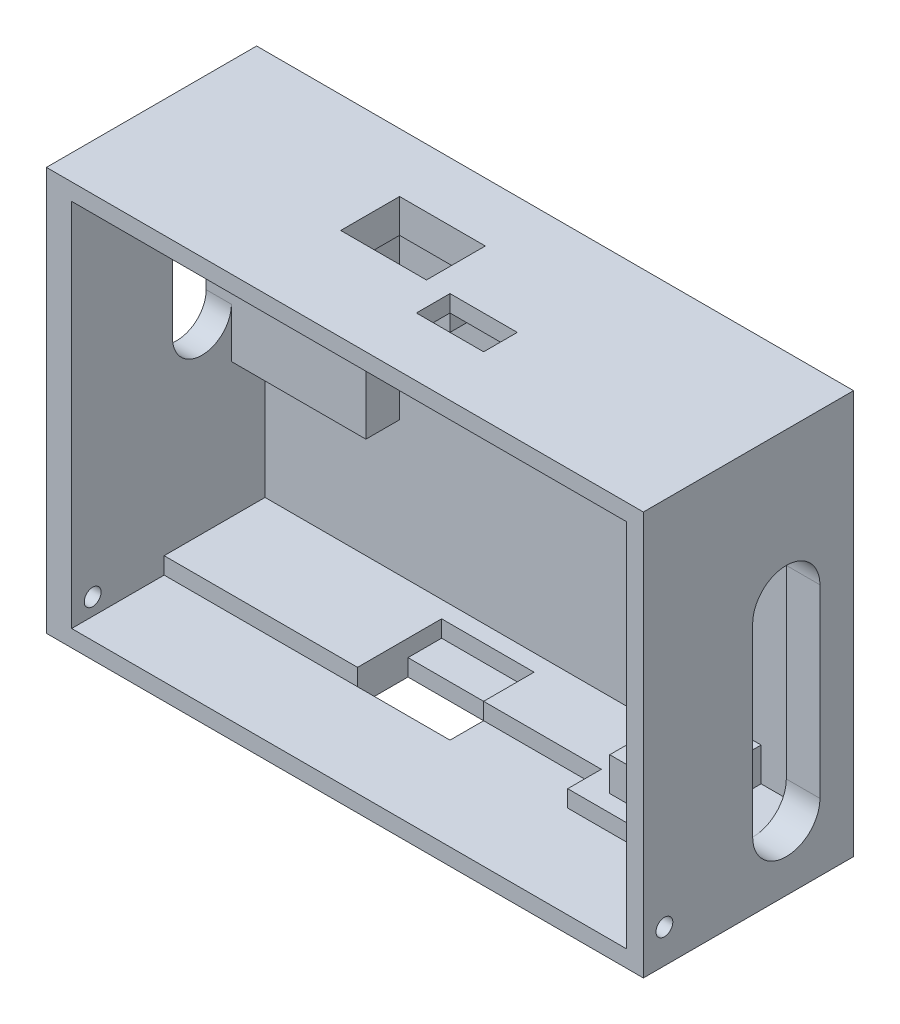
from build123d import *

# Parameters (mm, degrees)
SKETCH_1_W           = 35.5
SKETCH_1_H           = 24
EXTRUDE_1_DEPTH      = 12.5
SKETCH_2_W           = 33
SKETCH_2_H           = 22
CUT_EXTRUDE_1_DEPTH  = 11.5
CUT_EXTRUDE_2_DEPTH  = 2
EXTRUDE_2_DEPTH      = 6
SKETCH_7_W           = 4
SKETCH_7_H           = 2
SKETCH_7_W_2         = 5
EXTRUDE_3_DEPTH      = 5
CUT_EXTRUDE_4_DEPTH  = 2
SKETCH_11_R          = 0.5
CUT_EXTRUDE_5_DEPTH  = 35
SKETCH_12_W          = 5.5
SKETCH_12_H          = 1
CUT_EXTRUDE_6_DEPTH  = 5
SKETCH_15_W          = 5.5
SKETCH_15_H          = 3
CUT_EXTRUDE_7_DEPTH  = 5
SKETCH_16_W          = 5.1
SKETCH_16_H          = 3.5
CUT_EXTRUDE_8_DEPTH  = 5
SKETCH_18_W          = 7
SKETCH_18_H          = 1
FPC_DEPTH            = 2
SKETCH_19_W          = 8
SKETCH_19_H          = 12
USB_DEPTH            = 2
SKETCH_20_W          = 4
SKETCH_20_H          = 2
CUT_EXTRUDE_10_DEPTH = 2
SKETCH_21_W          = 4
SKETCH_21_H          = 1
CUT_EXTRUDE_11_DEPTH = 2


with BuildPart() as part:
    # 草图1 → 凸台-拉伸1 (new body)
    with BuildSketch(Plane.XY):
        Rectangle(SKETCH_1_W, SKETCH_1_H)
    extrude(amount=EXTRUDE_1_DEPTH)

    # 草图2 → 切除-拉伸1 (cut)
    with BuildSketch(Plane.XY.offset(12.5)):
        with Locations((0.25, 0)):
            Rectangle(SKETCH_2_W, SKETCH_2_H)
    extrude(amount=-CUT_EXTRUDE_1_DEPTH, mode=Mode.SUBTRACT)

    # 草图3 → 切除-拉伸2 (cut)
    with BuildSketch(Plane.ZY.offset(17.75)):
        with BuildLine():
            Line((6.5, 7.45), (6.5, 0.95))
            ThreePointArc((6.5, 0.95), (4.75, -0.8), (3, 0.95))
            Line((3, 0.95), (3, 7.45))
            ThreePointArc((3, 7.45), (4.75, 9.2), (6.5, 7.45))
        make_face()
    extrude(amount=-CUT_EXTRUDE_2_DEPTH, mode=Mode.SUBTRACT)

    # 草图6 → 凸台-拉伸2 (add)
    with BuildSketch(Plane.XY.offset(1)):
        Polygon((-16.25, 10), (15.75, 10), (15.75, -10), (-16.25, -10), (-16.25, -11), (16.75, -11), (16.75, 11), (-16.25, 11), align=None)
    extrude(amount=EXTRUDE_2_DEPTH)

    # 草图7 → 凸台-拉伸3 (add)
    with BuildSketch(Plane.XY.offset(1)):
        with Locations((11.25, -9)):
            Rectangle(SKETCH_7_W, SKETCH_7_H)
        with Locations((13.25, 9)):
            Rectangle(SKETCH_7_W_2, SKETCH_7_H)
    extrude(amount=EXTRUDE_3_DEPTH)

    # 草图10 → 切除-拉伸4 (cut)
    with BuildSketch(Plane.ZY.offset(-15.75)):
        with BuildLine():
            Line((2, -8), (2, 3))
            ThreePointArc((2, 3), (4, 5), (6, 3))
            Line((6, 3), (6, -8))
            ThreePointArc((6, -8), (4, -10), (2, -8))
        make_face()
    extrude(amount=-CUT_EXTRUDE_4_DEPTH, mode=Mode.SUBTRACT)

    # 草图11 → 切除-拉伸5 (cut)
    with BuildSketch(Plane(origin=(17.75, 0, 0), x_dir=(0, 0, -1), z_dir=(1, 0, 0))):
        with Locations((-11.25, -10)):
            Circle(SKETCH_11_R)
    extrude(amount=-CUT_EXTRUDE_5_DEPTH, mode=Mode.SUBTRACT)

    # 草图12 → 切除-拉伸6 (cut)
    with BuildSketch(Plane.XY.offset(7)):
        with Locations((-2, -10.5)):
            Rectangle(SKETCH_12_W, SKETCH_12_H)
    extrude(amount=-CUT_EXTRUDE_6_DEPTH, mode=Mode.SUBTRACT)

    # 草图15 → 切除-拉伸7 (cut)
    with BuildSketch(Plane(origin=(0, -11, 0), x_dir=(1, 0, 0), z_dir=(0, 1, 0))):
        with Locations((-2, -5.5)):
            Rectangle(SKETCH_15_W, SKETCH_15_H)
    extrude(amount=-CUT_EXTRUDE_7_DEPTH, mode=Mode.SUBTRACT)

    # 草图16 → 切除-拉伸8 (cut)
    with BuildSketch(Plane.XZ.offset(-10)):
        with Locations((-3.2, 5.25)):
            Rectangle(SKETCH_16_W, SKETCH_16_H)
    extrude(amount=-CUT_EXTRUDE_8_DEPTH, mode=Mode.SUBTRACT)

    # 草图18 → FPC排线间隙 (cut)
    with BuildSketch(Plane.XY.offset(7)):
        with Locations((4.25, -10.5)):
            Rectangle(SKETCH_18_W, SKETCH_18_H)
    extrude(amount=-FPC_DEPTH, mode=Mode.SUBTRACT)

    # 草图19 → USB支撑 (add)
    with BuildSketch(Plane.XY.offset(1)):
        with Locations((-12.25, 4)):
            Rectangle(SKETCH_19_W, SKETCH_19_H)
    extrude(amount=USB_DEPTH)

    # 草图20 → 切除-拉伸10 (cut)
    with BuildSketch(Plane(origin=(0, 12, 0), x_dir=(1, 0, 0), z_dir=(0, 1, 0))):
        with Locations((2.75, -8)):
            Rectangle(SKETCH_20_W, SKETCH_20_H)
    extrude(amount=-CUT_EXTRUDE_10_DEPTH, mode=Mode.SUBTRACT)

    # 草图21 → 切除-拉伸11 (cut)
    with BuildSketch(Plane.XY.offset(7)):
        with Locations((2.75, 10.5)):
            Rectangle(SKETCH_21_W, SKETCH_21_H)
    extrude(amount=-CUT_EXTRUDE_11_DEPTH, mode=Mode.SUBTRACT)


solid = part.part
